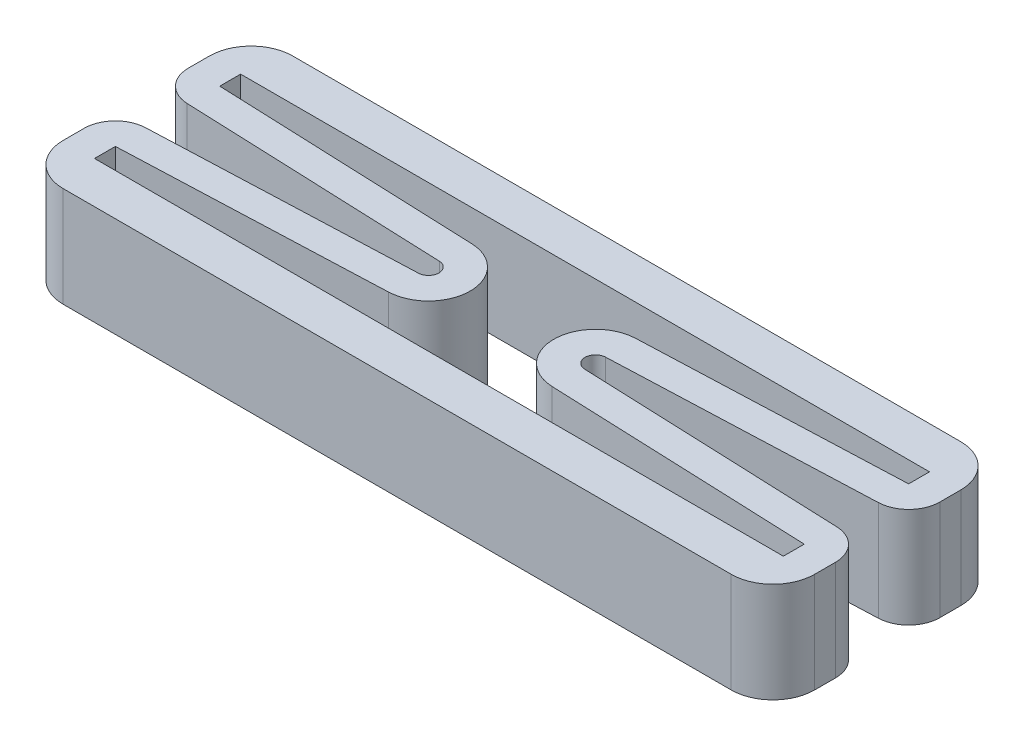
from build123d import *

# Parameters (mm, degrees)
BOSS_EXTRUDE1_DEPTH = 4.8


with BuildPart() as part:
    # Sketch1 → Boss-Extrude1 (new body)
    with BuildSketch(Plane(origin=(0, 0, 0), x_dir=(1, 0, 0), z_dir=(0, 1, 0))):
        with BuildLine():
            Line((18, 3.5), (18, 2.5))
            ThreePointArc((18, 2.5), (17.581582801, 1.460683569), (16.559761807, 1.001190964))
            Line((16.559761807, 1.001190964), (3.980079398, 0.499603012))
            ThreePointArc((3.980079398, 0.499603012), (3.5, 0), (3.980079398, -0.499603012))
            Line((3.980079398, -0.499603012), (16.559761807, -1.001190964))
            ThreePointArc((16.559761807, -1.001190964), (17.581582801, -1.460683569), (18, -2.5))
            Line((18, -2.5), (18, -3.5))
            ThreePointArc((18, -3.5), (17.414213562, -4.914213562), (16, -5.5))
            Line((16, -5.5), (-16, -5.5))
            ThreePointArc((-16, -5.5), (-17.414213562, -4.914213562), (-18, -3.5))
            Line((-18, -3.5), (-18, -2.5))
            ThreePointArc((-18, -2.5), (-17.581582801, -1.460683569), (-16.559761807, -1.001190964))
            Line((-16.559761807, -1.001190964), (-3.980079398, -0.499603012))
            ThreePointArc((-3.980079398, -0.499603012), (-3.5, 0), (-3.980079398, 0.499603012))
            Line((-3.980079398, 0.499603012), (-16.559761807, 1.001190964))
            ThreePointArc((-16.559761807, 1.001190964), (-17.581582801, 1.460683569), (-18, 2.5))
            Line((-18, 2.5), (-18, 3.5))
            ThreePointArc((-18, 3.5), (-17.414213562, 4.914213562), (-16, 5.5))
            Line((-16, 5.5), (16, 5.5))
            ThreePointArc((16, 5.5), (17.414213562, 4.914213562), (18, 3.5))
        make_face()
        with BuildLine():
            Line((16.5, 3.5), (-16.5, 3.5))
            Line((-16.5, 3.5), (-16.5, 2.5))
            Line((-16.5, 2.5), (-3.92031759, 1.998412048))
            ThreePointArc((-3.92031759, 1.998412048), (-2, 0), (-3.92031759, -1.998412048))
            Line((-3.92031759, -1.998412048), (-16.5, -2.5))
            Line((-16.5, -2.5), (-16.5, -3.5))
            Line((-16.5, -3.5), (16.5, -3.5))
            Line((16.5, -3.5), (16.5, -2.5))
            Line((16.5, -2.5), (3.92031759, -1.998412048))
            ThreePointArc((3.92031759, -1.998412048), (2, 0), (3.92031759, 1.998412048))
            Line((3.92031759, 1.998412048), (16.5, 2.5))
            Line((16.5, 2.5), (16.5, 3.5))
        make_face(mode=Mode.SUBTRACT)
    extrude(amount=BOSS_EXTRUDE1_DEPTH)


solid = part.part
